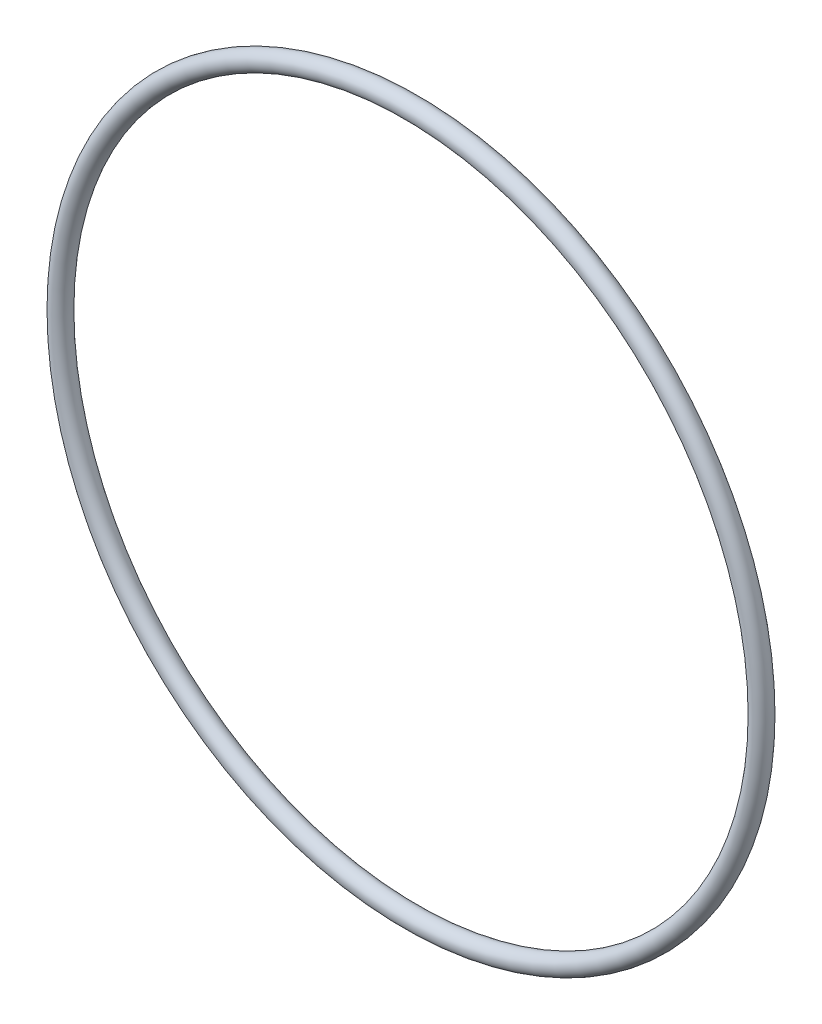
from build123d import *

# Parameters (mm, degrees)
SKETCH2_R = 1.7653


with BuildPart() as part:
    # Sketch2 → Revolve1 (revolve)
    with BuildSketch(Plane(origin=(0, 0, 0), x_dir=(1, 0, 0), z_dir=(0, 1, 0)), mode=Mode.PRIVATE) as revolve1_sk:
        with Locations((-65.0621, 0)):
            Circle(SKETCH2_R)
    revolve(revolve1_sk.sketch.rotate(Axis((0, 0, 1.7653), (0, 0, -1)), 180), axis=Axis((0, 0, 1.7653), (0, 0, -1)))


solid = part.part
